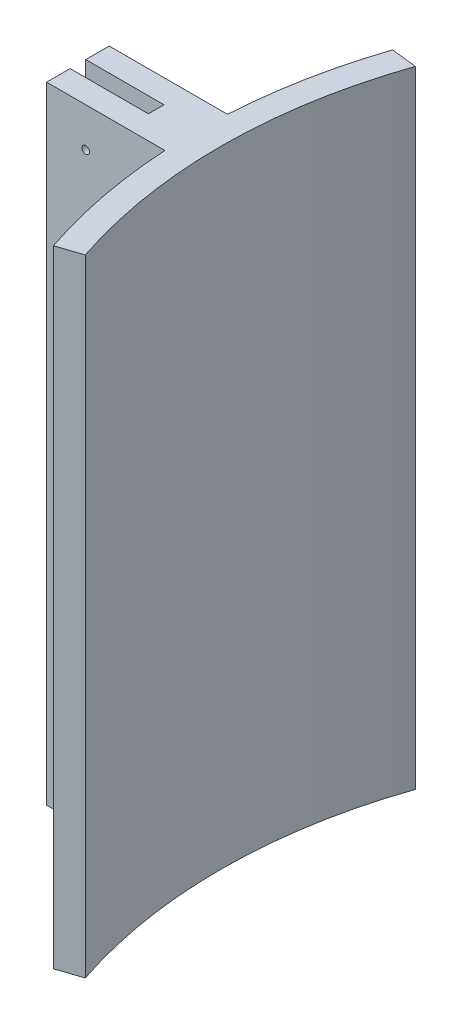
from build123d import *

# Parameters (mm, degrees)
BOSS_EXTRUDE1_DEPTH      = 80
M1_2X0_25_TAPPED_HOLE2_D = 0.95


with BuildPart() as part:
    # Sketch1 → Boss-Extrude1 (new body)
    with BuildSketch(Plane(origin=(0, 0, 0), x_dir=(1, 0, 0), z_dir=(0, 1, 0))):
        with BuildLine():
            Line((-61.633653719, -20.646857612), (-64.689519502, -21.670552005))
            ThreePointArc((-64.689519502, -21.670552005), (-66.98272443, -12.948412474), (-68.105409166, -4))
            Line((-68.105409166, -4), (-68.222773013, -4))
            Line((-68.222773013, -4), (-83.222773013, -4))
            Line((-83.222773013, -4), (-83.222773013, -1))
            Line((-83.222773013, -1), (-73.222773013, -1))
            Line((-73.222773013, -1), (-73.222773013, 1))
            Line((-73.222773013, 1), (-83.222773013, 1))
            Line((-83.222773013, 1), (-83.222773013, 4))
            Line((-83.222773013, 4), (-68.222773013, 4))
            Line((-68.222773013, 4), (-68.105409166, 4))
            ThreePointArc((-68.105409166, 4), (-66.98272443, 12.948412474), (-64.689519502, 21.670552005))
            Line((-64.689519502, 21.670552005), (-61.40887094, 21.306115786))
            ThreePointArc((-61.40887094, 21.306115786), (-64.999067015, 0.348263061), (-61.633653719, -20.646857612))
        make_face()
    extrude(amount=BOSS_EXTRUDE1_DEPTH)

    # M1.2x0.25 Tapped Hole2 (through all)
    with Locations(Plane.XY.offset(4)):
        with Locations((-78.222773013, 75), (-78.222773013, 40), (-78.222773013, 5)):
            Hole(M1_2X0_25_TAPPED_HOLE2_D / 2)


solid = part.part
